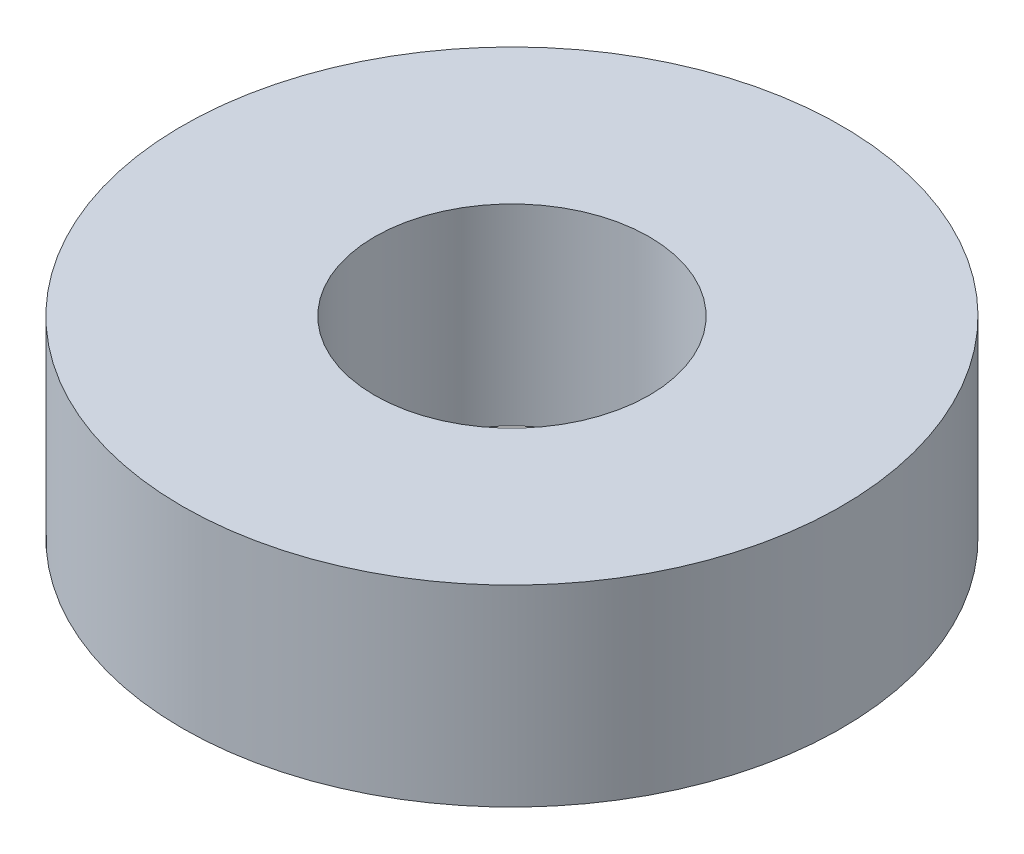
from build123d import *

# Parameters (mm, degrees)
SKETCH_1_R      = 12
SKETCH_1_R_2    = 5
EXTRUDE_1_DEPTH = 7


with BuildPart() as part:
    # 草图1 → 凸台-拉伸1 (new body)
    with BuildSketch(Plane(origin=(0, 0, 0), x_dir=(1, 0, 0), z_dir=(0, 1, 0))):
        with Locations(Location((0, 0, 0), (0, 0, 270))):
            Circle(SKETCH_1_R)
        with Locations(Location((0, 0, 0), (0, 0, 270))):
            Circle(SKETCH_1_R_2, mode=Mode.SUBTRACT)
    extrude(amount=EXTRUDE_1_DEPTH)


solid = part.part
